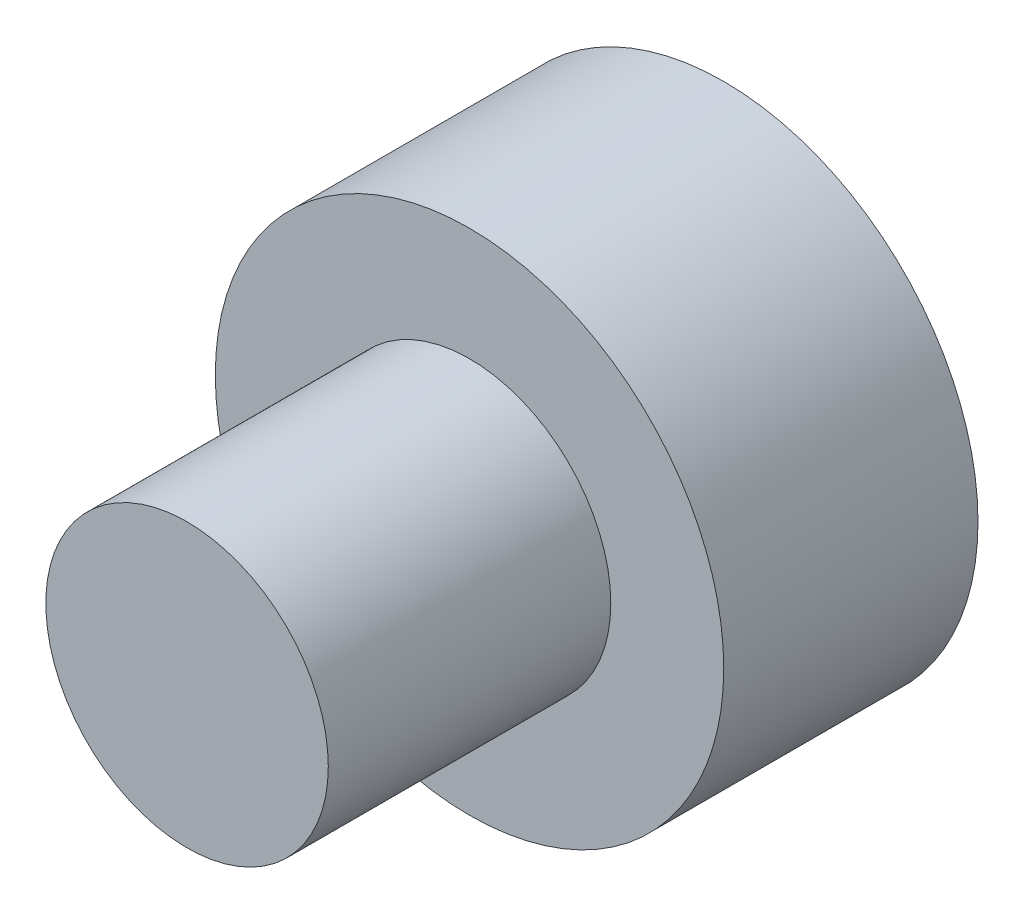
from build123d import *

# Parameters (mm, degrees)
SKETCH1_R           = 4.5
BOSS_EXTRUDE3_DEPTH = 4.5
CUT_EXTRUDE2_DEPTH  = 2
SKETCH5_R           = 2.5
BOSS_EXTRUDE4_DEPTH = 5


with BuildPart() as part:
    # Sketch1 → Boss-Extrude3 (new body)
    with BuildSketch(Plane.XY):
        Circle(SKETCH1_R)
    extrude(amount=BOSS_EXTRUDE3_DEPTH)

    # Sketch4 → Cut-Extrude2 (cut)
    with BuildSketch(Plane(origin=(0, 0, 0), x_dir=(-1, 0, 0), z_dir=(0, 0, -1))):
        Polygon((3.150328976, 0.094133336), (1.493642628, 2.775331592), (-1.656686348, 2.681198256), (-3.150328976, -0.094133336), (-1.493642628, -2.775331592), (1.656686348, -2.681198256), align=None)
    extrude(amount=-CUT_EXTRUDE2_DEPTH, mode=Mode.SUBTRACT)

    # Sketch5 → Boss-Extrude4 (add)
    with BuildSketch(Plane.XY.offset(4.5)):
        Circle(SKETCH5_R)
    extrude(amount=BOSS_EXTRUDE4_DEPTH)


solid = part.part
